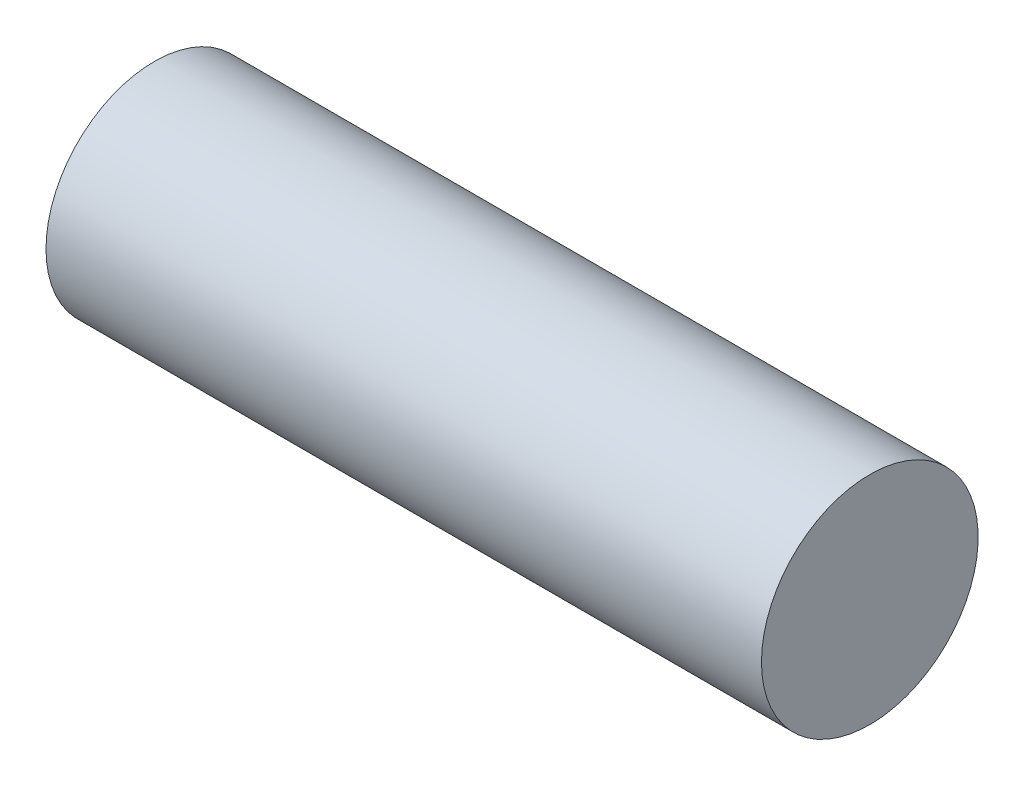
from build123d import *

# Parameters (mm, degrees)
SKETCH2_W = 70
SKETCH2_H = 10.6


with BuildPart() as part:
    # Sketch2 → Revolve1 (revolve)
    with BuildSketch(Plane.XY, mode=Mode.PRIVATE) as revolve1_sk:
        with Locations((0, 5.3)):
            Rectangle(SKETCH2_W, SKETCH2_H)
    revolve(revolve1_sk.sketch.rotate(Axis((-35, 0, 0), (1, 0, 0)), 90), axis=Axis((-35, 0, 0), (1, 0, 0)))


solid = part.part
